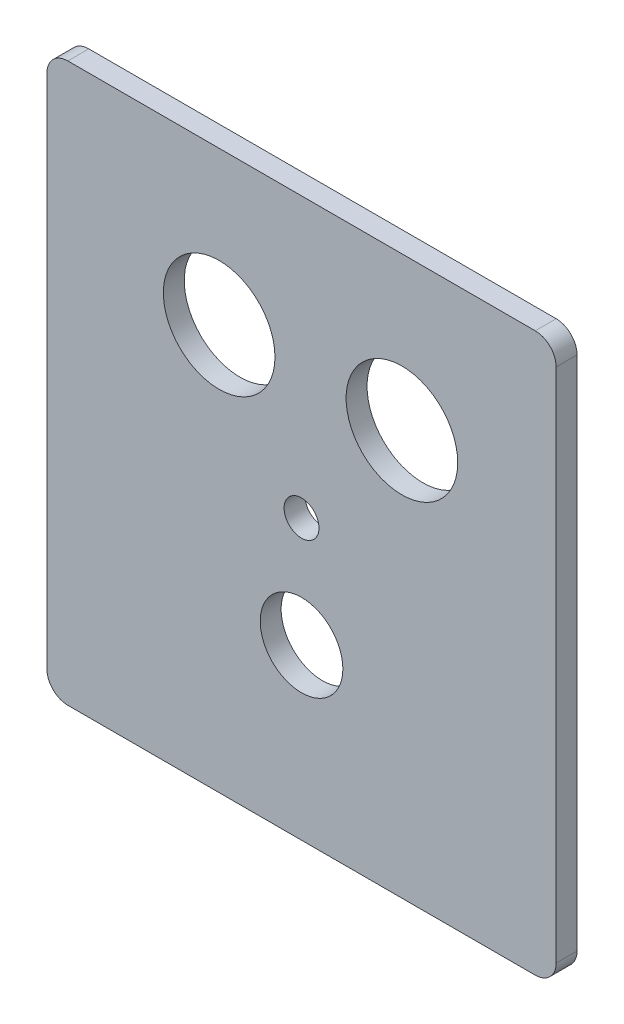
from build123d import *

# Parameters (mm, degrees)
BOSS_EXTRUDE2_DEPTH = 3
SKETCH3_R           = 8
SKETCH3_R_2         = 2.5
SKETCH3_R_3         = 5.925
CUT_EXTRUDE3_DEPTH  = 3


with BuildPart() as part:
    # Sketch2 → Boss-Extrude2 (new body)
    with BuildSketch(Plane.XY):
        with BuildLine():
            Line((-105.952702328, 11.694948853), (-38.952702328, 11.694948853))
            ThreePointArc((-38.952702328, 11.694948853), (-36.831381985, 10.816269197), (-35.952702328, 8.694948853))
            Line((-35.952702328, 8.694948853), (-35.952702328, -65.305051147))
            ThreePointArc((-35.952702328, -65.305051147), (-36.831381985, -67.42637149), (-38.952702328, -68.305051147))
            Line((-38.952702328, -68.305051147), (-105.952702328, -68.305051147))
            ThreePointArc((-105.952702328, -68.305051147), (-108.074022672, -67.42637149), (-108.952702328, -65.305051147))
            Line((-108.952702328, -65.305051147), (-108.952702328, 8.694948853))
            ThreePointArc((-108.952702328, 8.694948853), (-108.074022672, 10.816269197), (-105.952702328, 11.694948853))
        make_face()
    extrude(amount=BOSS_EXTRUDE2_DEPTH)

    # Sketch3 → Cut-Extrude3 (cut)
    with BuildSketch(Plane.XY.offset(3)):
        with Locations((-84.262702328, -10.233385412)):
            Circle(SKETCH3_R)
        with Locations((-58.062702328, -10.233385412)):
            Circle(SKETCH3_R)
        with Locations((-72.454362532, -28.305051147)):
            Circle(SKETCH3_R_2)
        with Locations((-72.452702328, -44.07552637)):
            Circle(SKETCH3_R_3)
    extrude(amount=-CUT_EXTRUDE3_DEPTH, mode=Mode.SUBTRACT)


solid = part.part
